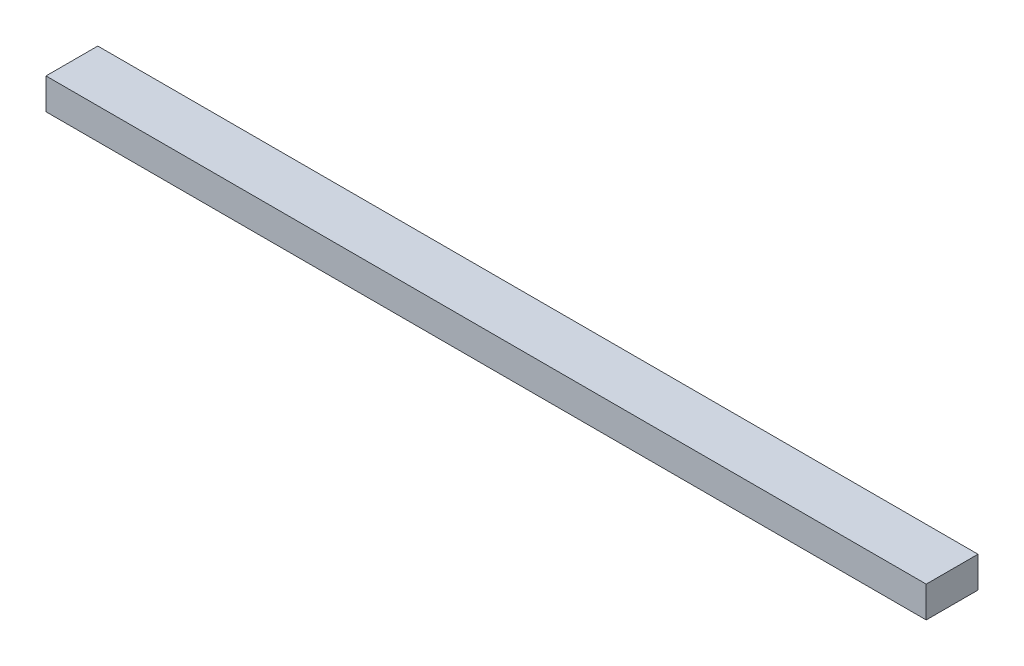
from build123d import *

# Parameters (mm, degrees)
SKETCH1_W           = 170
SKETCH1_H           = 10
BOSS_EXTRUDE1_DEPTH = 6


with BuildPart() as part:
    # Sketch1 → Boss-Extrude1 (new body)
    with BuildSketch(Plane(origin=(0, 0, 0), x_dir=(1, 0, 0), z_dir=(0, 1, 0))):
        Rectangle(SKETCH1_W, SKETCH1_H)
    extrude(amount=BOSS_EXTRUDE1_DEPTH)


solid = part.part
